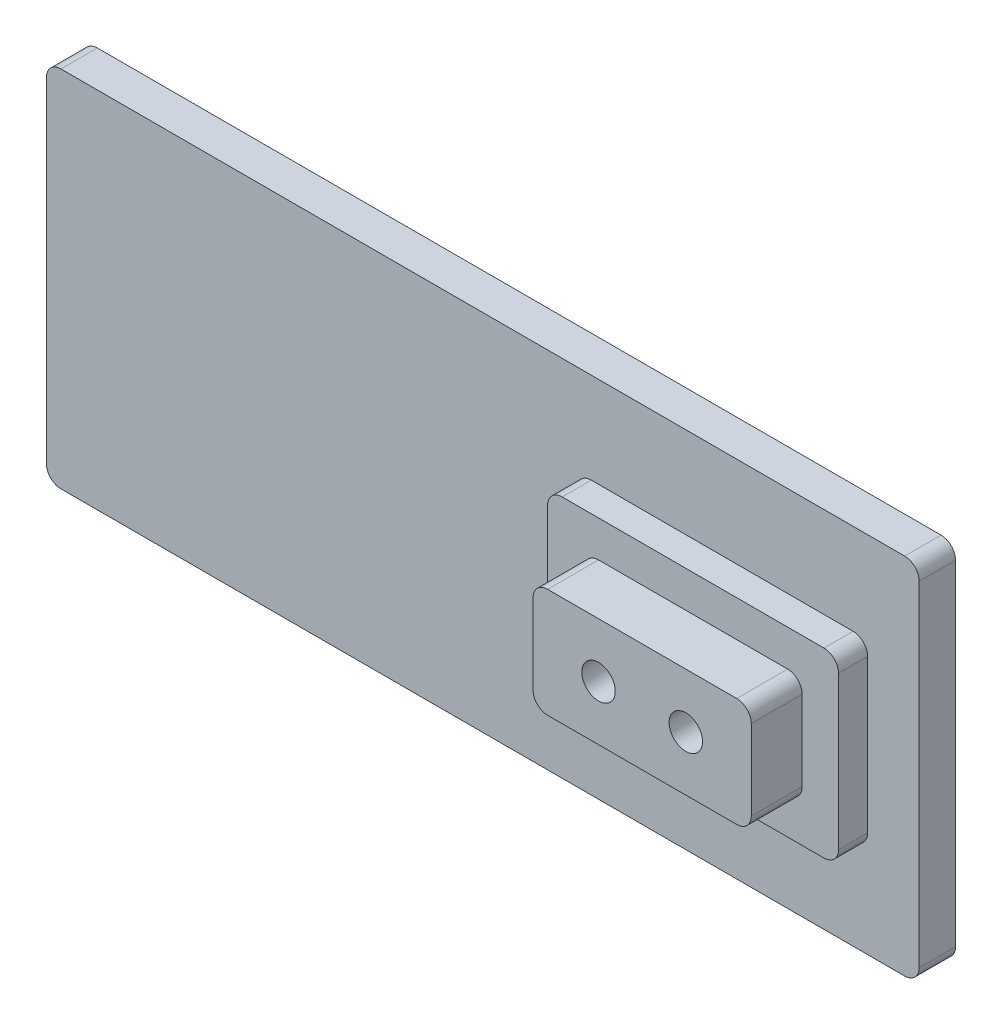
from build123d import *

# Parameters (mm, degrees)
CROQUIS1_W              = 30
CROQUIS1_H              = 15
CROQUIS1_R              = 2.3
SALIENTE_EXTRUIR1_DEPTH = 16
CROQUIS2_W              = 120
CROQUIS2_H              = 50
CROQUIS2_R              = 3.5
SALIENTE_EXTRUIR2_DEPTH = 5
CROQUIS3_W              = 40
CROQUIS3_H              = 25
CROQUIS3_W_2            = 30
CROQUIS3_H_2            = 15
SALIENTE_EXTRUIR3_DEPTH = 4
CORTAR_EXTRUIR1_DEPTH   = 5
REDONDEO1_R             = 2


with BuildPart() as part:
    # Croquis1 → Saliente-Extruir1 (new body)
    with BuildSketch(Plane.XY):
        Rectangle(CROQUIS1_W, CROQUIS1_H)
        with Locations((6, 0)):
            Circle(CROQUIS1_R, mode=Mode.SUBTRACT)
        with Locations(Location((-6, 0, 0), (0, 0, 180))):
            Circle(CROQUIS1_R, mode=Mode.SUBTRACT)
    extrude(amount=SALIENTE_EXTRUIR1_DEPTH)

    # Croquis2 → Saliente-Extruir2 (add)
    with BuildSketch(Plane(origin=(0, 0, 0), x_dir=(-1, 0, 0), z_dir=(0, 0, -1))):
        with Locations((32.909933797, 0)):
            Rectangle(CROQUIS2_W, CROQUIS2_H)
        with Locations((-6, 0)):
            Circle(CROQUIS2_R, mode=Mode.SUBTRACT)
        with Locations((6, 0)):
            Circle(CROQUIS2_R, mode=Mode.SUBTRACT)
    extrude(amount=-SALIENTE_EXTRUIR2_DEPTH)

    # Croquis3 → Saliente-Extruir3 (add)
    with BuildSketch(Plane.XY.offset(5)):
        Rectangle(CROQUIS3_W, CROQUIS3_H)
        Rectangle(CROQUIS3_W_2, CROQUIS3_H_2, mode=Mode.SUBTRACT)
    extrude(amount=SALIENTE_EXTRUIR3_DEPTH)

    # Croquis4 → Cortar-Extruir1 (cut)
    with BuildSketch(Plane(origin=(0, 0, 0), x_dir=(-1, 0, 0), z_dir=(0, 0, -1))):
        with BuildLine():
            Line((6, 7.5), (-6, 7.5))
            ThreePointArc((-6, 7.5), (-13.5, 0), (-6, -7.5))
            Line((-6, -7.5), (6, -7.5))
            ThreePointArc((6, -7.5), (13.5, 0), (6, 7.5))
        make_face()
    extrude(amount=-CORTAR_EXTRUIR1_DEPTH, mode=Mode.SUBTRACT)

    # Redondeo1
    redondeo1_edges = [part.edges().sort_by_distance(p)[0] for p in [
        (27.090066203, -25, 2.5),
        (27.090066203, 25, 2.5),
        (-92.909933797, 25, 2.5),
        (-92.909933797, -25, 2.5),
        (20, -12.5, 7),
        (20, 12.5, 7),
        (-20, 12.5, 7),
        (-20, -12.5, 7),
        (15, -7.5, 12.5),
        (-15, -7.5, 12.5),
        (-15, 7.5, 12.5),
        (15, 7.5, 12.5),
    ]]
    fillet(redondeo1_edges, radius=REDONDEO1_R)


solid = part.part
